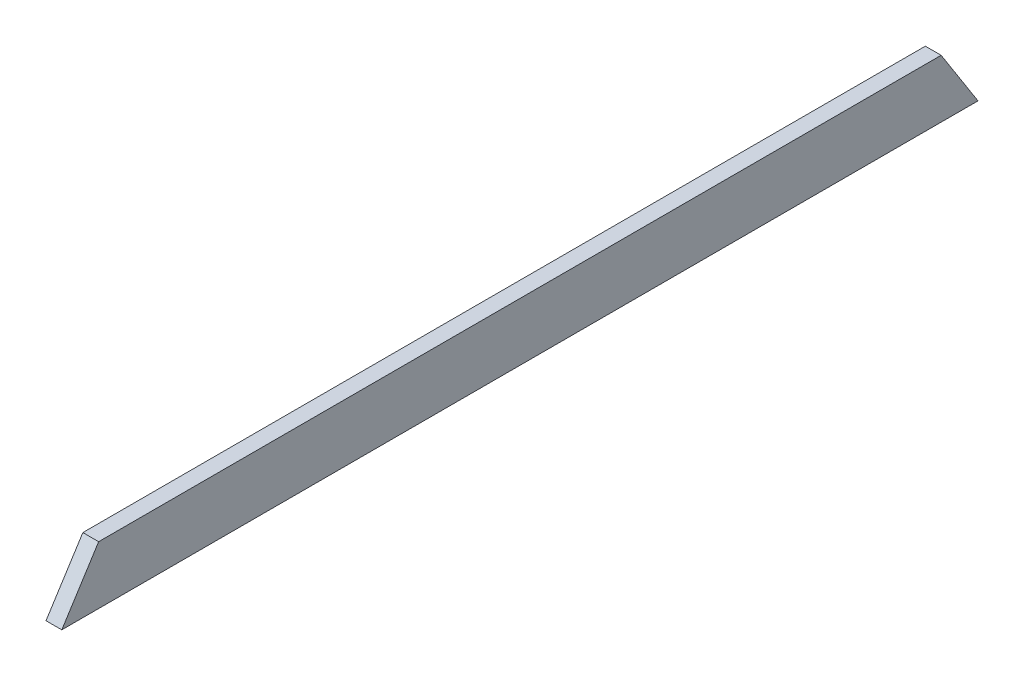
from build123d import *

# Parameters (mm, degrees)
EXTRUDE_1_DEPTH = 3


with BuildPart() as part:
    # Эскиз1 → Бобышка-Вытянуть1 (new body)
    with BuildSketch(Plane(origin=(0, 0, 0), x_dir=(0, 0, -1), z_dir=(1, 0, 0))):
        Polygon((-87, 0), (87, 0), (80, 11), (-80, 11), align=None)
    extrude(amount=EXTRUDE_1_DEPTH)


solid = part.part
